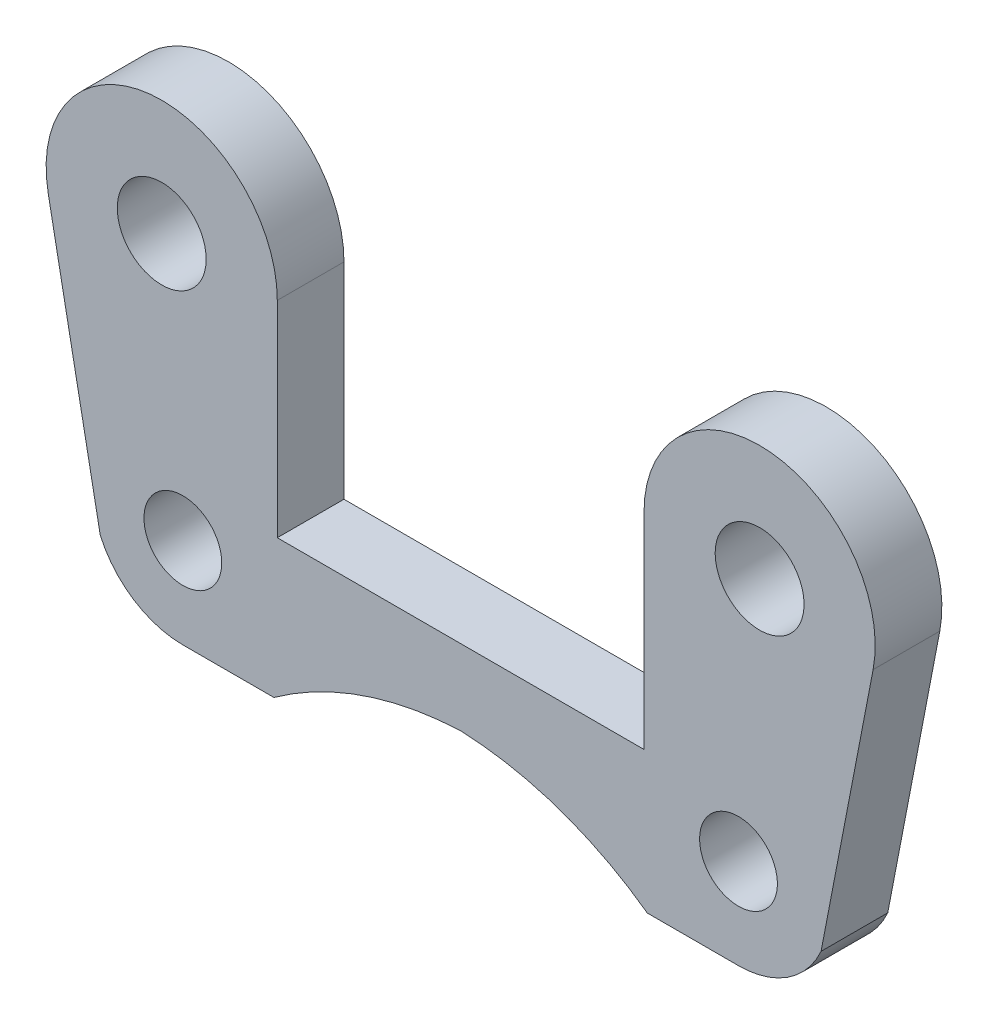
from build123d import *

# Parameters (mm, degrees)
SKETCH1_R           = 4
SKETCH1_R_2         = 3.5
BOSS_EXTRUDE1_DEPTH = 6


with BuildPart() as part:
    # Sketch1 → Boss-Extrude1 (new body)
    with BuildSketch(Plane.XY):
        with BuildLine():
            Line((-25, -41.5), (-16.8, -41.5))
            ThreePointArc((-16.8, -41.5), (-8.828360495, -37.359231669), (0, -35.7))
            ThreePointArc((0, -35.7), (8.828360495, -37.359231669), (16.8, -41.5))
            Line((16.8, -41.5), (25, -41.5))
            ThreePointArc((25, -41.5), (29.432022337, -40.185877375), (32.431413249, -36.668293768))
            Line((32.431413249, -36.668293768), (37.115311752, -12.370570289))
            ThreePointArc((37.115311752, -12.370570289), (27.890603154, -0.04711718), (16.5, -10.401676805))
            Line((16.5, -10.401676805), (16.5, -28.9))
            Line((16.5, -28.9), (-16.5, -28.9))
            Line((-16.5, -28.9), (-16.5, -10.401676805))
            ThreePointArc((-16.5, -10.401676805), (-27.890603154, -0.04711718), (-37.115311752, -12.370570289))
            Line((-37.115311752, -12.370570289), (-32.431413249, -36.668293768))
            ThreePointArc((-32.431413249, -36.668293768), (-29.432022337, -40.185877375), (-25, -41.5))
        make_face()
        with Locations((-26.901676805, -10.401676805)):
            Circle(SKETCH1_R, mode=Mode.SUBTRACT)
        with Locations((-25, -33.369198558)):
            Circle(SKETCH1_R_2, mode=Mode.SUBTRACT)
        with Locations(Location((25, -33.369198558, 0), (0, 0, 180))):
            Circle(SKETCH1_R_2, mode=Mode.SUBTRACT)
        with Locations(Location((26.901676805, -10.401676805, 0), (0, 0, 180))):
            Circle(SKETCH1_R, mode=Mode.SUBTRACT)
    extrude(amount=BOSS_EXTRUDE1_DEPTH)


solid = part.part
